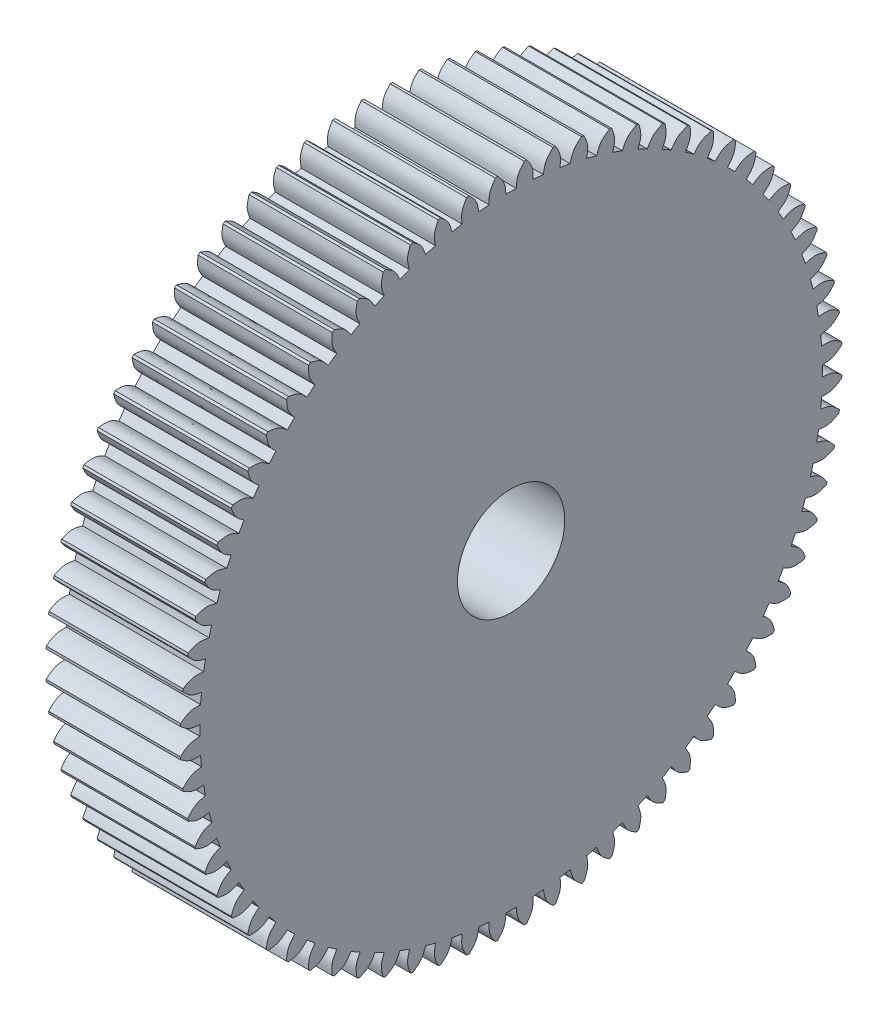
from build123d import *

# Parameters (mm, degrees)
RITNING_1_W      = 15
RITNING_1_H      = 31
KUGGLUCKA_DEPTH  = 15
CIRPATTERN_COUNT = 72


with BuildPart() as part:
    # Ritning 1 → Kugghjulsämne (revolve)
    with BuildSketch(Plane.XY, mode=Mode.PRIVATE) as kugghjuls_mne_sk:
        with Locations((0, 3)):
            Rectangle(RITNING_1_W, RITNING_1_H)
    revolve(kugghjuls_mne_sk.sketch.rotate(Axis((-7.5, -18.5, 0), (1, 0, 0)), 90), axis=Axis((-7.5, -18.5, 0), (1, 0, 0)))

    # Ritning 2 → Kugglucka (cut)
    with BuildSketch(Plane.ZY.offset(7.5)):
        with BuildLine():
            Line((1.471119099, 18.470742603), (0, 19.941861702))
            Line((0, 19.941861702), (-1.471119099, 18.470742603))
            add(Edge.make_bspline(
                [(-1.471119099, 18.470742603), (-1.203017898, 18.160678457), (-0.662530279, 17.535594229), (-0.603985126, 16.710882897), (-0.574480463, 16.295257898)],
                knots=[0, 0, 0, 0, 0.496035786, 1, 1, 1, 1], degree=3))
            ThreePointArc((-0.574480463, 16.295257898), (0, 16.3), (0.574480463, 16.295257898))
            add(Edge.make_bspline(
                [(1.471119099, 18.470742603), (1.203017898, 18.160678457), (0.662530279, 17.535594229), (0.603985126, 16.710882897), (0.574480463, 16.295257898)],
                knots=[0, 0, 0, 0, 0.496035786, 1, 1, 1, 1], degree=3))
        make_face()
    kugglucka = extrude(amount=-KUGGLUCKA_DEPTH, mode=Mode.SUBTRACT)

    # CirPattern: Kugglucka ×72 about axis
    cirpattern_axis = Axis((-7.5, -18.5, 0), (-1, 0, 0))
    for i in range(1, CIRPATTERN_COUNT):
        add(kugglucka.rotate(cirpattern_axis, i * 360 / CIRPATTERN_COUNT), mode=Mode.SUBTRACT)


solid = part.part
